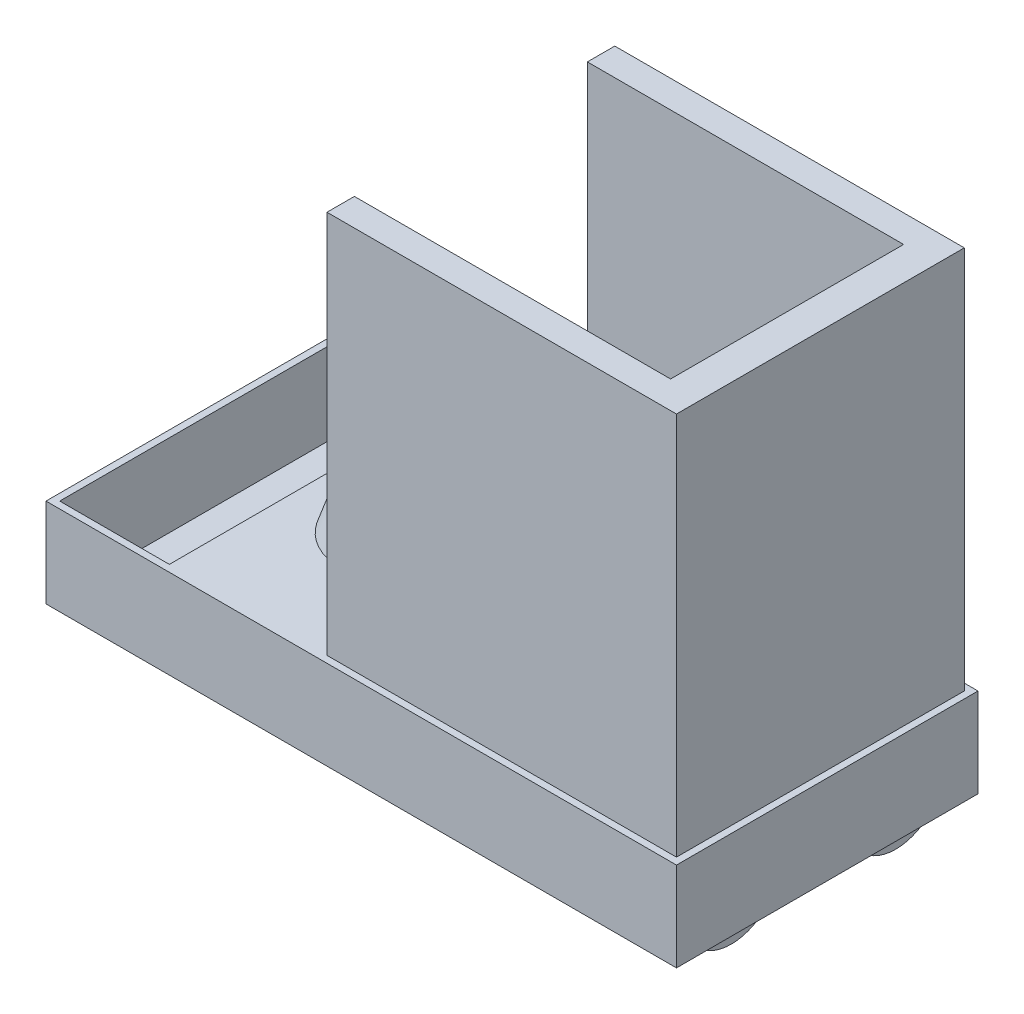
from build123d import *

# Parameters (mm, degrees)
CHASIS_W                = 457.2
CHASIS_H                = 279.4
BOSS_EXTRUDE1_DEPTH     = 82.55
SKETCH3_W               = 44.45
SKETCH3_H               = 44.45
MIRROR2_COPY_1_SKETCH_W = 44.45
MIRROR2_COPY_1_SKETCH_H = 44.45
BOSS_EXTRUDE2_DEPTH     = 355.6
SKETCH6_R               = 44.45
SKETCH5_R               = 57.15
SKETCH10_W              = 279.4
SKETCH10_H              = 82.55
BOSS_EXTRUDE3_DEPTH     = 127
SKETCH11_W              = 101.6
SKETCH11_H              = 266.7
CUT_EXTRUDE1_DEPTH      = 76.2
SKETCH13_W              = 50.8
SKETCH13_H              = 25.4
BOSS_EXTRUDE5_DEPTH     = 76.2
SKETCH15_R              = 12.7
CUT_EXTRUDE2_DEPTH      = 25.4


with BuildPart() as part:
    # Chasis → Boss-Extrude1 (new body)
    with BuildSketch(Plane(origin=(0, 0, 0), x_dir=(1, 0, 0), z_dir=(0, 1, 0))):
        Rectangle(CHASIS_W, CHASIS_H)
    extrude(amount=BOSS_EXTRUDE1_DEPTH)

    # Sketch3 → Revolve1 (revolve)
    with BuildSketch(Plane(origin=(0, 25.4, 0), x_dir=(-1, 0, 0), z_dir=(0, -1, 0))):
        with Locations((193.675, -98.425)):
            Rectangle(SKETCH3_W, SKETCH3_H)
    revolve1 = revolve(axis=Axis((-215.9, 25.4, 76.2), (1, 0, 0)))

    # Mirror1: Revolve1 across plane
    add(revolve1.mirror(Plane.XY))

    # Mirror2: Revolve1 across plane
    add(revolve1.mirror(Plane(origin=(0, 0, 0), x_dir=(0, 0, 1), z_dir=(1, 0, 0))))

    # Mirror2 copy 1 sketch → Mirror2 copy 1 (revolve)
    with BuildSketch(Plane.XZ.offset(-25.4)):
        with Locations((193.675, -98.425)):
            Rectangle(MIRROR2_COPY_1_SKETCH_W, MIRROR2_COPY_1_SKETCH_H)
    revolve(axis=Axis((215.9, 25.4, -76.2), (-1, 0, 0)))

    # Sketch4 → Boss-Extrude2 (add)
    with BuildSketch(Plane(origin=(0, 82.55, 0), x_dir=(1, 0, 0), z_dir=(0, 1, 0))):
        Polygon((222.25, 133.35), (-101.6, 133.35), (-101.6, 107.95), (191.407142857, 107.95), (191.407142857, -107.95), (-101.6, -107.95), (-101.6, -133.35), (222.25, -133.35), align=None)
    extrude(amount=BOSS_EXTRUDE2_DEPTH)

    # Sketch6 → Loft1 section 0
    with BuildSketch(Plane(origin=(0, 120.65, 0), x_dir=(1, 0, 0), z_dir=(0, 1, 0))):
        with Locations((-165.1, 0)):
            Circle(SKETCH6_R)
    # Sketch5 → Loft1 section 1
    with BuildSketch(Plane(origin=(0, 82.55, 0), x_dir=(1, 0, 0), z_dir=(0, 1, 0))):
        with Locations((-165.1, 0)):
            Circle(SKETCH5_R)
    loft()

    # Sketch10 → Boss-Extrude3 (add)
    with BuildSketch(Plane.ZY.offset(228.6)):
        with Locations((0, 41.275)):
            Rectangle(SKETCH10_W, SKETCH10_H)
    extrude(amount=BOSS_EXTRUDE3_DEPTH)

    # Sketch11 → Cut-Extrude1 (cut)
    with BuildSketch(Plane(origin=(0, 82.55, 0), x_dir=(1, 0, 0), z_dir=(0, 1, 0))):
        with Locations((-298.45, 0)):
            Rectangle(SKETCH11_W, SKETCH11_H)
    extrude(amount=-CUT_EXTRUDE1_DEPTH, mode=Mode.SUBTRACT)

    # Sketch13 → Boss-Extrude5 (add)
    with BuildSketch(Plane(origin=(0, 120.65, 0), x_dir=(1, 0, 0), z_dir=(0, 1, 0))):
        with Locations((-165.1, 0)):
            Rectangle(SKETCH13_W, SKETCH13_H)
    extrude(amount=BOSS_EXTRUDE5_DEPTH)

    # Sketch15 → Cut-Extrude2 (cut)
    with BuildSketch(Plane.XY.offset(12.7)):
        with Locations((-164.332091847, 177.8)):
            Circle(SKETCH15_R)
    extrude(amount=-CUT_EXTRUDE2_DEPTH, mode=Mode.SUBTRACT)


solid = part.part
